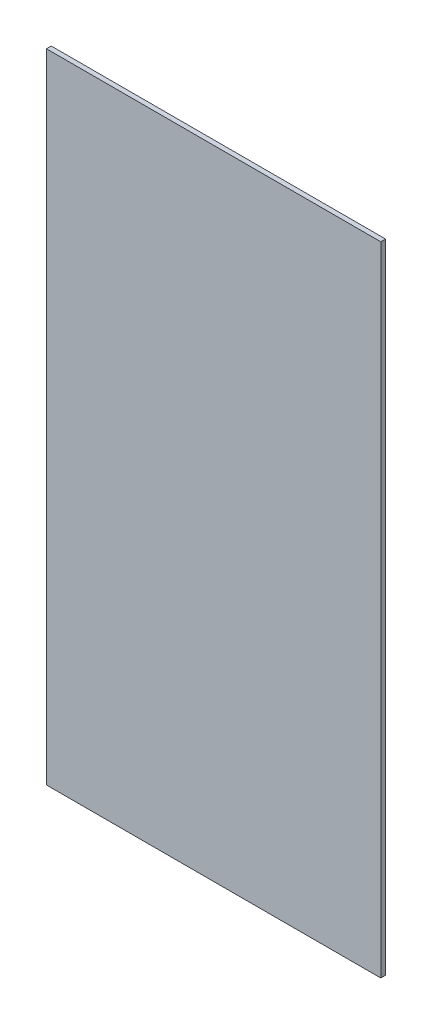
from build123d import *

# Parameters (mm, degrees)
SKETCH_1_W          = 279.576527547
SKETCH_1_H          = 4
EXTRUDE_1_DEPTH     = 533.213673317
SKETCH_2_W          = 50
SKETCH_2_H          = 50
CUT_EXTRUDE_1_DEPTH = 3


with BuildPart() as part:
    # Эскиз1 → Вытянуть1 (new body)
    with BuildSketch(Plane(origin=(0, 0, 0), x_dir=(1, 0, 0), z_dir=(0, 1, 0))):
        with Locations((-4.999950783, -4.341392103)):
            Rectangle(SKETCH_1_W, SKETCH_1_H)
    extrude(amount=EXTRUDE_1_DEPTH)

    # Эскиз2 → Вырез-Вытянуть1 (cut)
    with BuildSketch(Plane(origin=(0, 0, 2.341392103), x_dir=(-1, 0, 0), z_dir=(0, 0, -1))):
        with Locations((38.911430126, 66.344991557)):
            Rectangle(SKETCH_2_W, SKETCH_2_H)
    extrude(amount=-CUT_EXTRUDE_1_DEPTH, mode=Mode.SUBTRACT)


solid = part.part
